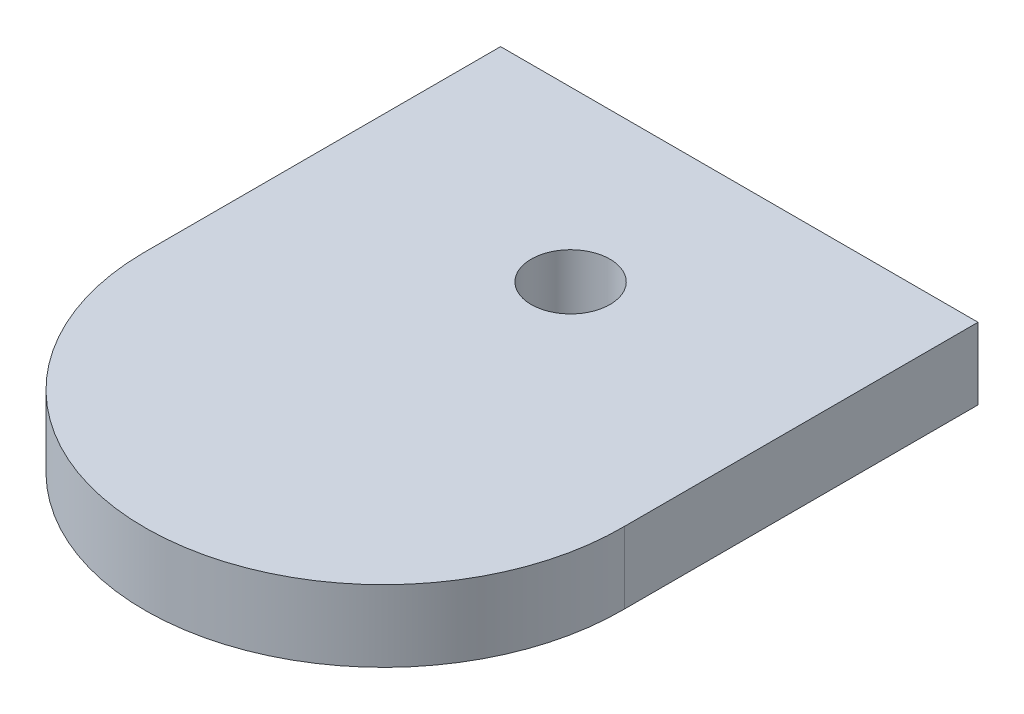
from build123d import *

# Parameters (mm, degrees)
SKETCH_1_R      = 1.65
EXTRUDE_1_DEPTH = 3


with BuildPart() as part:
    # 草图1 → 凸台-拉伸1 (new body)
    with BuildSketch(Plane(origin=(0, 0, 0), x_dir=(1, 0, 0), z_dir=(0, 1, 0))):
        with BuildLine():
            Line((10, 0.098814229), (10, 14.901185771))
            Line((10, 14.901185771), (-10, 14.901185771))
            Line((-10, 14.901185771), (-10, -0.098814229))
            ThreePointArc((-10, -0.098814229), (0.098814229, -10), (10, 0.098814229))
        make_face()
        with Locations(Location((0, 7.833913126, 0), (0, 0, 270))):
            Circle(SKETCH_1_R, mode=Mode.SUBTRACT)
    extrude(amount=EXTRUDE_1_DEPTH)


solid = part.part
